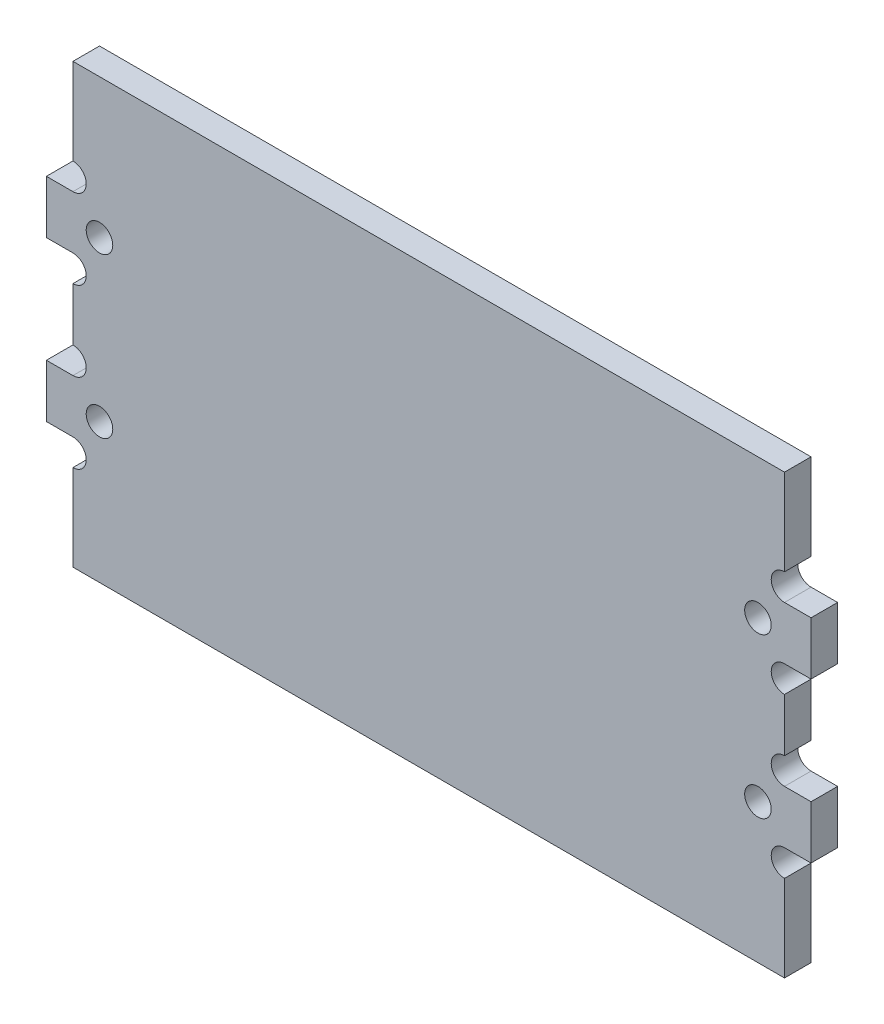
from build123d import *

# Parameters (mm, degrees)
SKETCH_1_R      = 1
EXTRUDE_1_DEPTH = 2


with BuildPart() as part:
    # 草圖1 → 填料-伸長1 (new body)
    with BuildSketch(Plane.XY):
        with BuildLine():
            Line((-28.161562759, 19.347959184), (-29.161562759, 19.347959184))
            Line((-29.161562759, 19.347959184), (-29.161562759, 18.347959184))
            Line((-29.161562759, 18.347959184), (-29.161562759, 12.847959184))
            ThreePointArc((-29.161562759, 12.847959184), (-28.161562759, 11.847959184), (-29.161562759, 10.847959184))
            Line((-29.161562759, 10.847959184), (-31.161562759, 10.847959184))
            Line((-31.161562759, 10.847959184), (-31.161562759, 6.847959184))
            Line((-31.161562759, 6.847959184), (-29.161562759, 6.847959184))
            ThreePointArc((-29.161562759, 6.847959184), (-28.161562759, 5.847959184), (-29.161562759, 4.847959184))
            Line((-29.161562759, 4.847959184), (-29.161562759, 0.847959184))
            ThreePointArc((-29.161562759, 0.847959184), (-28.161562759, -0.152040816), (-29.161562759, -1.152040816))
            Line((-29.161562759, -1.152040816), (-31.161562759, -1.152040816))
            Line((-31.161562759, -1.152040816), (-31.161562759, -5.152040816))
            Line((-31.161562759, -5.152040816), (-29.161562759, -5.152040816))
            ThreePointArc((-29.161562759, -5.152040816), (-28.161562759, -6.152040816), (-29.161562759, -7.152040816))
            Line((-29.161562759, -7.152040816), (-29.161562759, -12.652040816))
            Line((-29.161562759, -12.652040816), (-29.161562759, -13.652040816))
            Line((-29.161562759, -13.652040816), (-28.161562759, -13.652040816))
            Line((-28.161562759, -13.652040816), (23.438437241, -13.652040816))
            Line((23.438437241, -13.652040816), (24.438437241, -13.652040816))
            Line((24.438437241, -13.652040816), (24.438437241, -12.652040816))
            Line((24.438437241, -12.652040816), (24.438437241, -7.152040816))
            ThreePointArc((24.438437241, -7.152040816), (23.438437241, -6.152040816), (24.438437241, -5.152040816))
            Line((24.438437241, -5.152040816), (26.438437241, -5.152040816))
            Line((26.438437241, -5.152040816), (26.438437241, -1.152040816))
            Line((26.438437241, -1.152040816), (24.438437241, -1.152040816))
            ThreePointArc((24.438437241, -1.152040816), (23.438437241, -0.152040816), (24.438437241, 0.847959184))
            Line((24.438437241, 0.847959184), (24.438437241, 4.847959184))
            ThreePointArc((24.438437241, 4.847959184), (23.438437241, 5.847959184), (24.438437241, 6.847959184))
            Line((24.438437241, 6.847959184), (26.438437241, 6.847959184))
            Line((26.438437241, 6.847959184), (26.438437241, 10.847959184))
            Line((26.438437241, 10.847959184), (24.438437241, 10.847959184))
            ThreePointArc((24.438437241, 10.847959184), (23.438437241, 11.847959184), (24.438437241, 12.847959184))
            Line((24.438437241, 12.847959184), (24.438437241, 18.347959184))
            Line((24.438437241, 18.347959184), (24.438437241, 19.347959184))
            Line((24.438437241, 19.347959184), (23.438437241, 19.347959184))
            Line((23.438437241, 19.347959184), (-28.161562759, 19.347959184))
        make_face()
        with Locations((22.438437241, 8.847959184)):
            Circle(SKETCH_1_R, mode=Mode.SUBTRACT)
        with Locations((-27.161562759, 8.847959184)):
            Circle(SKETCH_1_R, mode=Mode.SUBTRACT)
        with Locations((-27.161562759, -3.152040816)):
            Circle(SKETCH_1_R, mode=Mode.SUBTRACT)
        with Locations((22.438437241, -3.152040816)):
            Circle(SKETCH_1_R, mode=Mode.SUBTRACT)
    extrude(amount=EXTRUDE_1_DEPTH)


solid = part.part
